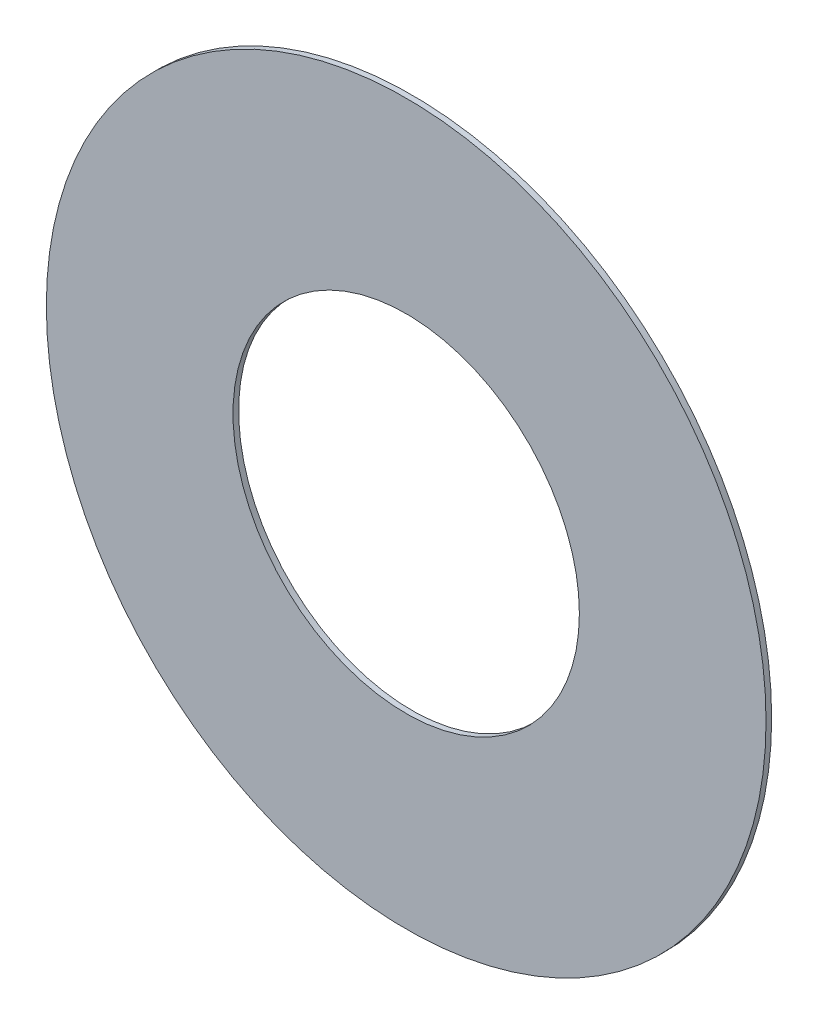
from build123d import *

# Parameters (mm, degrees)
SKETCH1_R           = 20.32
SKETCH1_R_2         = 9.779
BOSS_EXTRUDE1_DEPTH = 0.3175


with BuildPart() as part:
    # Sketch1 → Boss-Extrude1 (new body)
    with BuildSketch(Plane.XY):
        Circle(SKETCH1_R)
        Circle(SKETCH1_R_2, mode=Mode.SUBTRACT)
    extrude(amount=BOSS_EXTRUDE1_DEPTH)


solid = part.part
